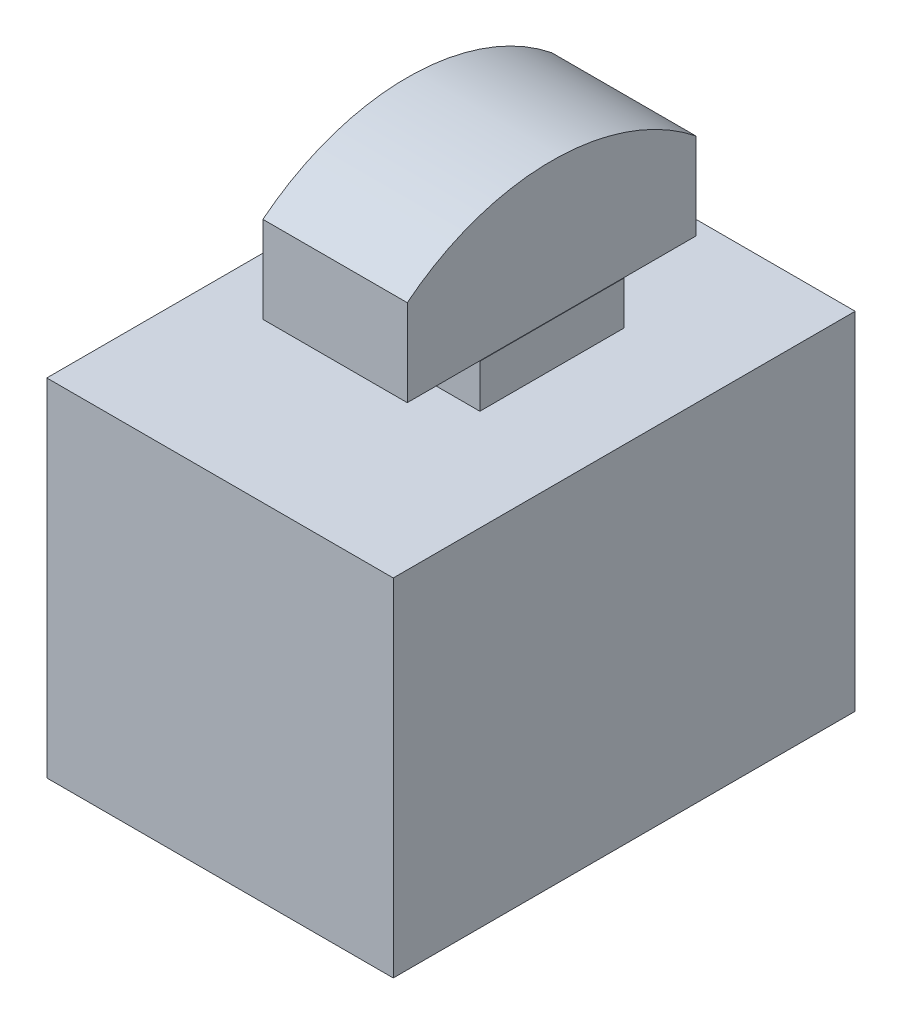
from build123d import *

# Parameters (mm, degrees)
SKETCH_1_W      = 12
SKETCH_1_H      = 12
EXTRUDE_1_DEPTH = 16
SKETCH_2_W      = 5
SKETCH_2_H      = 5
EXTRUDE_2_DEPTH = 1.5
SKETCH_3_W      = 5
SKETCH_3_H      = 10
EXTRUDE_3_DEPTH = 3
EXTRUDE_4_DEPTH = 5


with BuildPart() as part:
    # 스케치1 → 보스-돌출1 (new body)
    with BuildSketch(Plane.XY):
        Rectangle(SKETCH_1_W, SKETCH_1_H)
    extrude(amount=EXTRUDE_1_DEPTH)

    # 스케치2 → 보스-돌출2 (add)
    with BuildSketch(Plane(origin=(0, 6, 0), x_dir=(1, 0, 0), z_dir=(0, 1, 0))):
        with Locations((0, -7)):
            Rectangle(SKETCH_2_W, SKETCH_2_H)
    extrude(amount=EXTRUDE_2_DEPTH)

    # 스케치3 → 보스-돌출3 (add)
    with BuildSketch(Plane(origin=(0, 7.5, 0), x_dir=(1, 0, 0), z_dir=(0, 1, 0))):
        with Locations((-0.014967469, -7)):
            Rectangle(SKETCH_3_W, SKETCH_3_H)
    extrude(amount=EXTRUDE_3_DEPTH)

    # 스케치4 → 보스-돌출4 (add)
    with BuildSketch(Plane.ZY.offset(2.514967469)):
        with BuildLine():
            Line((2, 10.5), (12, 10.5))
            ThreePointArc((12, 10.5), (7, 12.255002002), (2, 10.5))
        make_face()
    extrude(amount=-EXTRUDE_4_DEPTH)


solid = part.part
